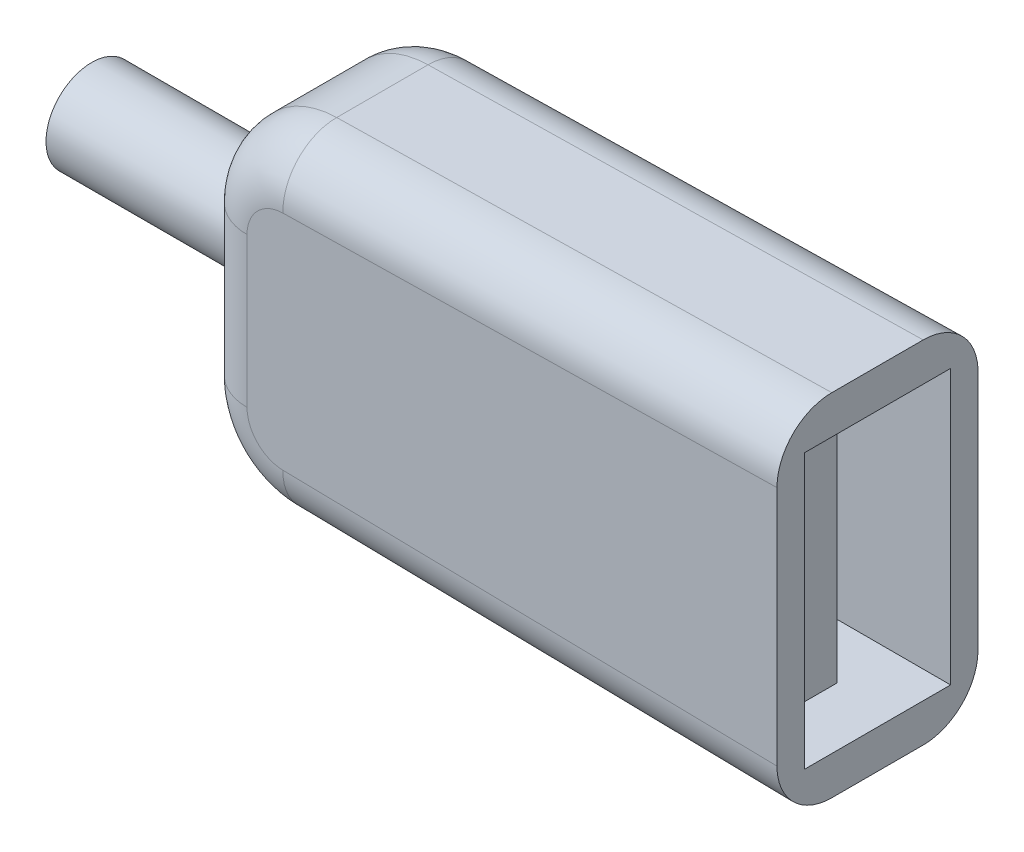
from build123d import *

# Parameters (mm, degrees)
SALIENTE_EXTRUIR1_DEPTH = 11
REDONDEO1_R             = 5
REDONDEO2_R             = 3
CROQUIS2_R              = 2.5
SALIENTE_EXTRUIR2_DEPTH = 11
CROQUIS3_W              = 8
CROQUIS3_H              = 15
CORTAR_EXTRUIR1_DEPTH   = 15
CROQUIS4_W              = 1.857543752
CROQUIS4_H              = 12.596468565
SALIENTE_EXTRUIR3_DEPTH = 13


with BuildPart() as part:
    # Croquis1 → Saliente-Extruir1 (new body)
    with BuildSketch(Plane.XY):
        Polygon((0, 9.6), (0, -9.6), (-32, -9), (-32, 9), align=None)
    extrude(amount=SALIENTE_EXTRUIR1_DEPTH)

    # Redondeo1
    redondeo1_edges = [part.edges().sort_by_distance(p)[0] for p in [
        (-32, -9, 5.5),
        (-32, 9, 5.5),
    ]]
    fillet(redondeo1_edges, radius=REDONDEO1_R)

    # Redondeo2
    redondeo2_edges = [part.edges().sort_by_distance(p)[0] for p in [
        (-13.546866762, 9.345996248, 11),
        (-13.546866762, -9.345996248, 0),
        (-13.546866762, -9.345996248, 11),
        (-32, 0, 0),
        (-30.568519835, 7.595108483, 0),
        (-30.568519835, -7.595108483, 0),
        (-32, 0, 11),
        (-30.568519835, 7.595108483, 11),
        (-30.568519835, -7.595108483, 11),
        (-13.546866762, 9.345996248, 0),
    ]]
    fillet(redondeo2_edges, radius=REDONDEO2_R)

    # Croquis2 → Saliente-Extruir2 (add)
    with BuildSketch(Plane.ZY.offset(32)):
        with Locations((5.5, 0)):
            Circle(CROQUIS2_R)
    extrude(amount=SALIENTE_EXTRUIR2_DEPTH)

    # Croquis3 → Cortar-Extruir1 (cut)
    with BuildSketch(Plane(origin=(0, 0, 0), x_dir=(0, 0, -1), z_dir=(1, 0, 0))):
        with Locations((-5.5, 0)):
            Rectangle(CROQUIS3_W, CROQUIS3_H)
    extrude(amount=-CORTAR_EXTRUIR1_DEPTH, mode=Mode.SUBTRACT)

    # Croquis4 → Saliente-Extruir3 (add)
    with BuildSketch(Plane(origin=(-15, 0, 0), x_dir=(0, 0, -1), z_dir=(1, 0, 0))):
        with Locations((-6.633221346, -0.002349923)):
            Rectangle(CROQUIS4_W, CROQUIS4_H)
    extrude(amount=SALIENTE_EXTRUIR3_DEPTH)


solid = part.part
